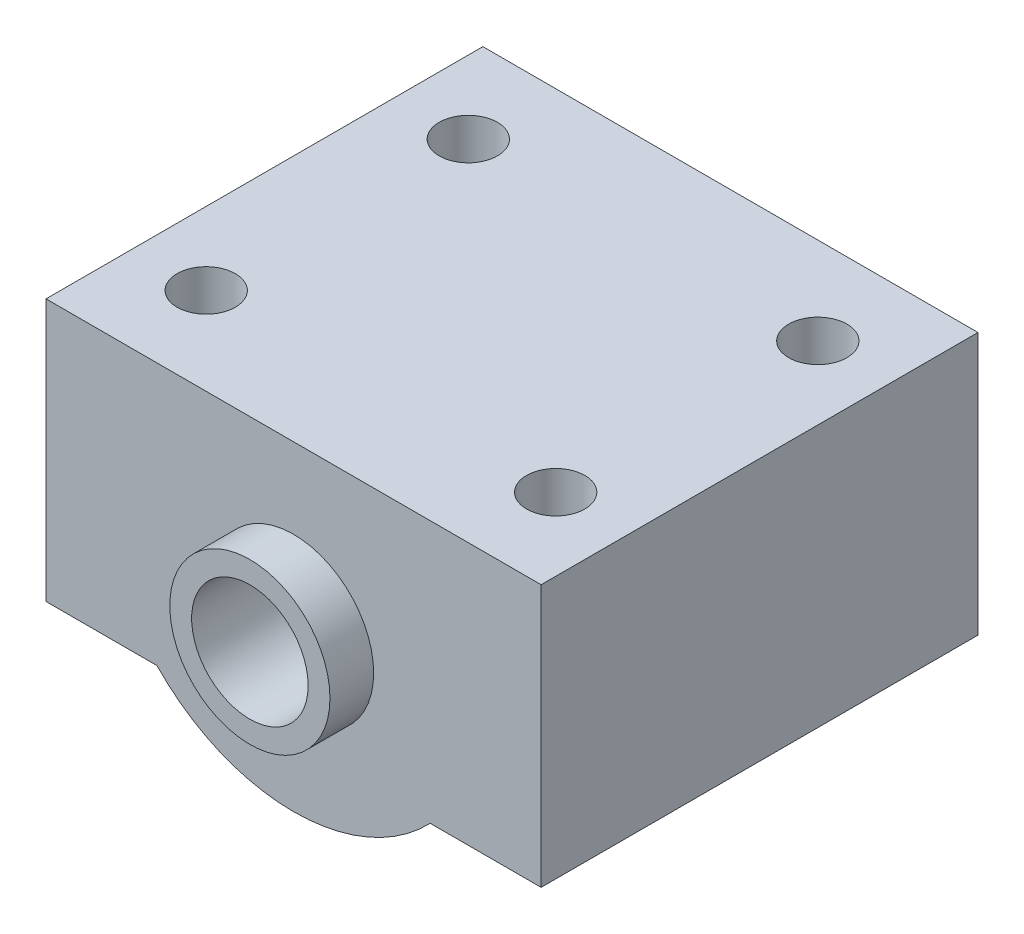
from build123d import *

# Parameters (mm, degrees)
BOSS_EXTRUDE1_DEPTH = 30
CUT_EXTRUDE1_REACH  = 38.851
SKETCH5_R           = 4
BOSS_EXTRUDE2_START = 3
SKETCH6_R           = 5.5
SKETCH6_R_2         = 4
BOSS_EXTRUDE2_DEPTH = 3
SKETCH7_R           = 5.5
SKETCH7_R_2         = 4
BOSS_EXTRUDE3_DEPTH = 3
SKETCH8_R           = 2
CUT_EXTRUDE2_DEPTH  = 6
SKETCH9_R           = 1.7
CUT_EXTRUDE3_DEPTH  = 10


with BuildPart() as part:
    # Sketch1 → Boss-Extrude1 (new body)
    with BuildSketch(Plane.XY):
        with BuildLine():
            Line((-9.38083152, -9), (-17, -9))
            Line((-17, -9), (-17, 9))
            Line((-17, 9), (17, 9))
            Line((17, 9), (17, -9))
            Line((17, -9), (9.38083152, -9))
            ThreePointArc((9.38083152, -9), (0, -13), (-9.38083152, -9))
        make_face()
    extrude(amount=BOSS_EXTRUDE1_DEPTH)

    # Sketch5 → Cut-Extrude1 (cut, up to next)
    with BuildSketch(Plane.XY.offset(30), mode=Mode.PRIVATE) as cut_extrude1_sk1:
        with Locations((0, -2)):
            Circle(SKETCH5_R)
    cut_extrude1_tool1 = extrude(cut_extrude1_sk1.sketch, amount=-CUT_EXTRUDE1_REACH, mode=Mode.PRIVATE) & part.part
    add(cut_extrude1_tool1.solids().sort_by_distance((0, -2, 30))[0], mode=Mode.SUBTRACT)

    # Sketch6 → Boss-Extrude2 (add)
    with BuildSketch(Plane.XY.offset(30).offset(BOSS_EXTRUDE2_START)):
        with Locations((0, -2)):
            Circle(SKETCH6_R)
        with Locations((0, -2)):
            Circle(SKETCH6_R_2, mode=Mode.SUBTRACT)
    extrude(amount=-BOSS_EXTRUDE2_DEPTH)

    # Sketch7 → Boss-Extrude3 (add)
    with BuildSketch(Plane(origin=(0, 0, 0), x_dir=(-1, 0, 0), z_dir=(0, 0, -1))):
        with Locations(Location((0, -2, 0), (0, 0, 180))):
            Circle(SKETCH7_R)
        with Locations(Location((0, -2, 0), (0, 0, 180))):
            Circle(SKETCH7_R_2, mode=Mode.SUBTRACT)
    extrude(amount=BOSS_EXTRUDE3_DEPTH)

    # Sketch8 → Cut-Extrude2 (cut)
    with BuildSketch(Plane(origin=(0, 9, 0), x_dir=(1, 0, 0), z_dir=(0, 1, 0))):
        with Locations(Location((-12, -6, 0), (0, 0, 180))):
            Circle(SKETCH8_R)
        with Locations((-12, -24)):
            Circle(SKETCH8_R)
        with Locations(Location((12, -24, 0), (0, 0, 180))):
            Circle(SKETCH8_R)
        with Locations((12, -6)):
            Circle(SKETCH8_R)
    extrude(amount=-CUT_EXTRUDE2_DEPTH, mode=Mode.SUBTRACT)

    # Sketch9 → Cut-Extrude3 (cut)
    with BuildSketch(Plane.XZ.offset(9)):
        with Locations(Location((-12, 27, 0), (0, 0, 270))):
            Circle(SKETCH9_R)
        with Locations(Location((-12, 3, 0), (0, 0, 90))):
            Circle(SKETCH9_R)
        with Locations(Location((12, 3, 0), (0, 0, 270))):
            Circle(SKETCH9_R)
        with Locations(Location((12, 27, 0), (0, 0, 90))):
            Circle(SKETCH9_R)
    extrude(amount=-CUT_EXTRUDE3_DEPTH, mode=Mode.SUBTRACT)


solid = part.part
